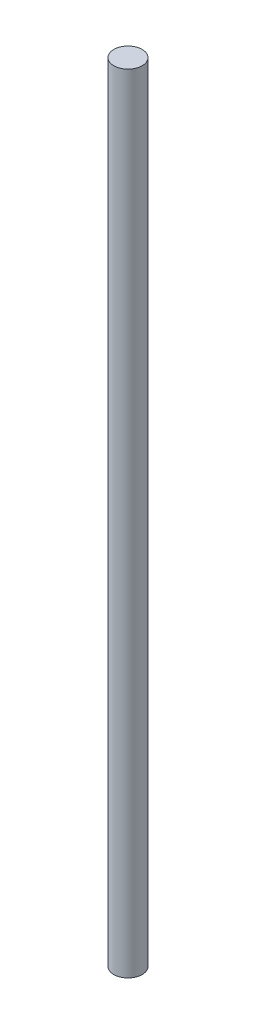
from build123d import *

# Parameters (mm, degrees)
SKETCH_1_R      = 9
EXTRUDE_1_DEPTH = 250


with BuildPart() as part:
    # 草图1 → 凸台-拉伸1 (new, symmetric)
    with BuildSketch(Plane(origin=(0, 0, 0), x_dir=(1, 0, 0), z_dir=(0, 1, 0))):
        with Locations(Location((0, 0, 0), (0, 0, 270))):
            Circle(SKETCH_1_R)
    extrude(amount=EXTRUDE_1_DEPTH, both=True)


solid = part.part
